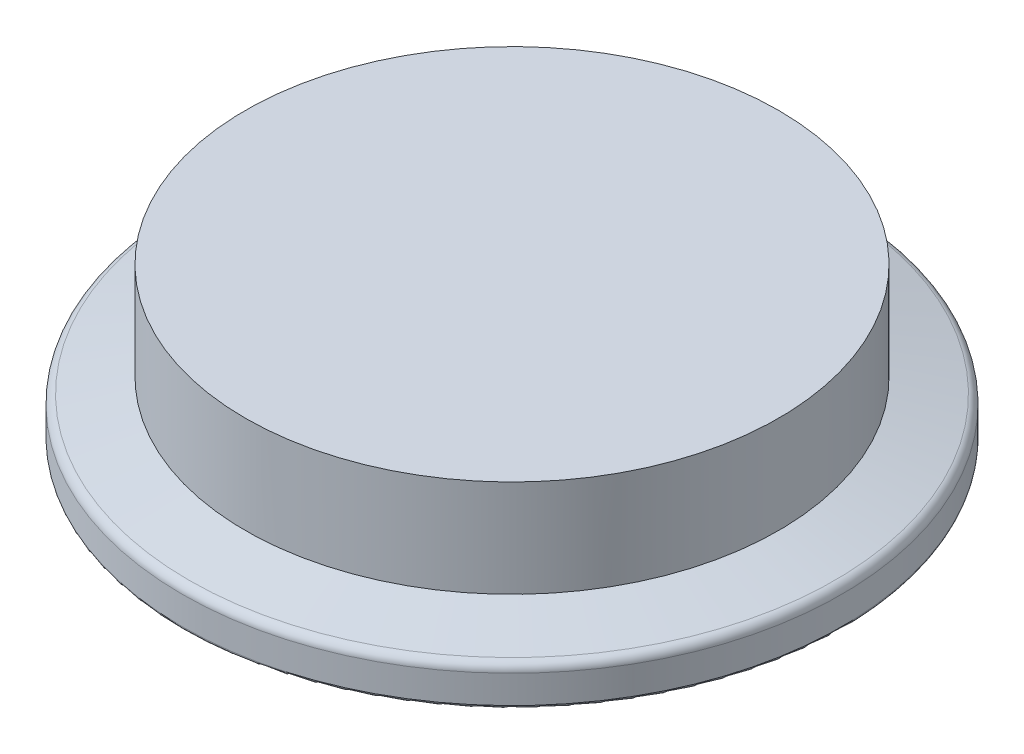
from build123d import *

# Parameters (mm, degrees)
SKETCH2_W  = 15.85
SKETCH2_H  = 2.5
SKETCH5_R  = 22.25
STUB_DEPTH = 10.2
FILLET1_R  = 0.762
FILLET2_R  = 0.254


with BuildPart() as part:
    # Sketch1 → Flange (revolve)
    with BuildSketch(Plane(origin=(0, 0, 0), x_dir=(0, 0, -1), z_dir=(1, 0, 0)), mode=Mode.PRIVATE) as flange_sk:
        Polygon((-27.5, 0), (-27.5, 3.175), (-20.315802195, 5.1), (0, 5.1), (0, 2.5), (-20.625, 2.5), (-20.625, 0), align=None)
    revolve(flange_sk.sketch.rotate(Axis((0, 0, 0), (0, 1, 0)), 180), axis=Axis((0, 0, 0), (0, 1, 0)))

    # Sketch2 → Blank Insert (revolve)
    with BuildSketch(Plane(origin=(0, 0, 0), x_dir=(0, 0, -1), z_dir=(1, 0, 0))):
        with Locations((-7.925, 1.25)):
            Rectangle(SKETCH2_W, SKETCH2_H)
    revolve(axis=Axis((0, 0, 0), (0, -1, 0)))

    # Sketch5 → Stub (add)
    with BuildSketch(Plane.XZ.offset(-2.5)):
        with Locations(Location((0, 0, 0), (0, 0, 270))):
            Circle(SKETCH5_R)
    extrude(amount=-STUB_DEPTH)

    # Fillet1
    fillet1_edges = [part.edges().sort_by_distance(p)[0] for p in [
        (0, 3.175, 27.5),
    ]]
    fillet(fillet1_edges, radius=FILLET1_R)

    # Fillet2
    fillet2_edges = [part.edges().sort_by_distance(p)[0] for p in [
        (0, 0, 27.5),
    ]]
    fillet(fillet2_edges, radius=FILLET2_R)


solid = part.part
